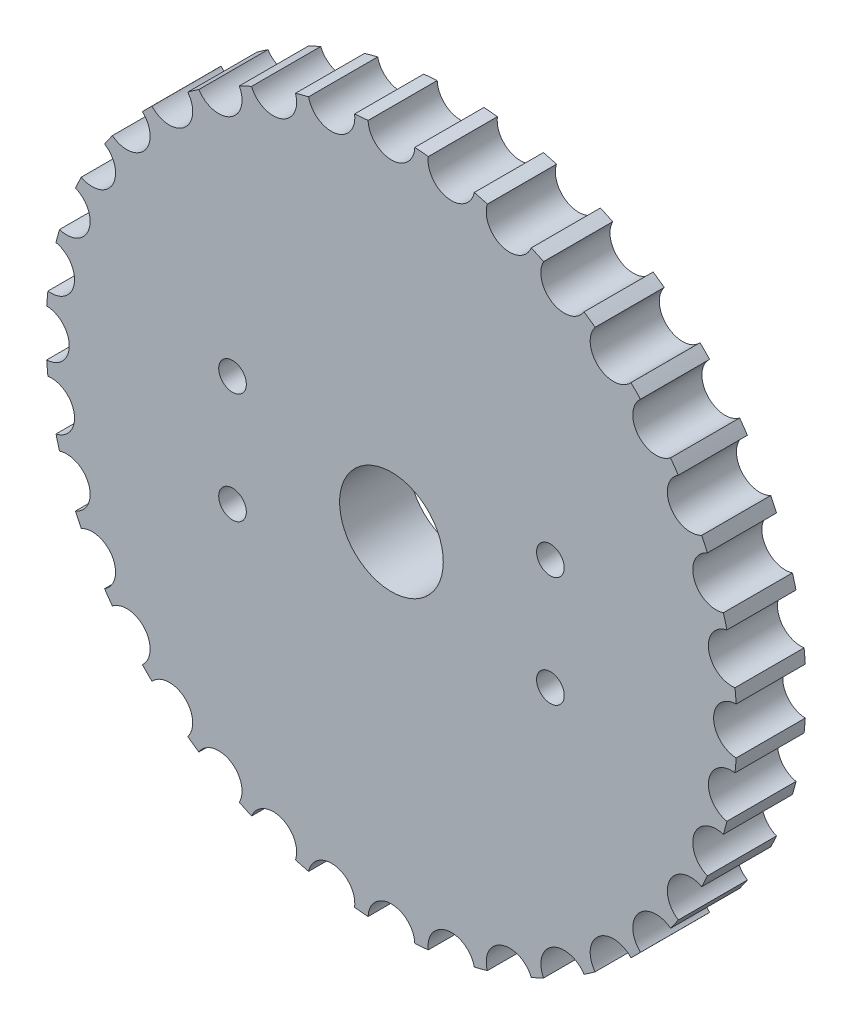
from build123d import *

# Parameters (mm, degrees)
SKETCH_1_R          = 50
EXTRUDE_1_DEPTH     = 10
SKETCH_4_R          = 7.5
CUT_EXTRUDE_3_DEPTH = 10
SKETCH_5_R          = 2
CUT_EXTRUDE_4_DEPTH = 10
SKETCH_6_R          = 3.38
CUT_EXTRUDE_5_DEPTH = 72.414284285


with BuildPart() as part:
    # 스케치1 → 보스-돌출1 (new body)
    with BuildSketch(Plane.XY):
        Circle(SKETCH_1_R)
    extrude(amount=EXTRUDE_1_DEPTH)

    # 스케치4 → 컷-돌출3 (cut)
    with BuildSketch(Plane.XY.offset(10)):
        Circle(SKETCH_4_R)
    extrude(amount=-CUT_EXTRUDE_3_DEPTH, mode=Mode.SUBTRACT)

    # 스케치5 → 컷-돌출4 (cut)
    with BuildSketch(Plane.XY.offset(10)):
        with Locations((-23, 8)):
            Circle(SKETCH_5_R)
        with Locations(Location((23, 8, 0), (0, 0, 180))):
            Circle(SKETCH_5_R)
        with Locations((23, -8)):
            Circle(SKETCH_5_R)
        with Locations(Location((-23, -8, 0), (0, 0, 180))):
            Circle(SKETCH_5_R)
    extrude(amount=-CUT_EXTRUDE_4_DEPTH, mode=Mode.SUBTRACT)

    # 스케치6 → 컷-돌출5 (cut, through all)
    with BuildSketch(Plane.XY.offset(10)):
        with Locations((0, 50)):
            Circle(SKETCH_6_R)
        with Locations((8.682408883, 49.240387651)):
            Circle(SKETCH_6_R)
        with Locations((17.101007166, 46.984631039)):
            Circle(SKETCH_6_R)
        with Locations((25, 43.301270189)):
            Circle(SKETCH_6_R)
        with Locations((32.139380484, 38.302222156)):
            Circle(SKETCH_6_R)
        with Locations((38.302222156, 32.139380484)):
            Circle(SKETCH_6_R)
        with Locations((43.301270189, 25)):
            Circle(SKETCH_6_R)
        with Locations((46.984631039, 17.101007166)):
            Circle(SKETCH_6_R)
        with Locations((49.240387651, 8.682408883)):
            Circle(SKETCH_6_R)
        with Locations((50, 0)):
            Circle(SKETCH_6_R)
        with Locations((49.240387651, -8.682408883)):
            Circle(SKETCH_6_R)
        with Locations((46.984631039, -17.101007166)):
            Circle(SKETCH_6_R)
        with Locations((43.301270189, -25)):
            Circle(SKETCH_6_R)
        with Locations((38.302222156, -32.139380484)):
            Circle(SKETCH_6_R)
        with Locations((32.139380484, -38.302222156)):
            Circle(SKETCH_6_R)
        with Locations((25, -43.301270189)):
            Circle(SKETCH_6_R)
        with Locations((17.101007166, -46.984631039)):
            Circle(SKETCH_6_R)
        with Locations((8.682408883, -49.240387651)):
            Circle(SKETCH_6_R)
        with Locations((0, -50)):
            Circle(SKETCH_6_R)
        with Locations((-8.682408883, -49.240387651)):
            Circle(SKETCH_6_R)
        with Locations((-17.101007166, -46.984631039)):
            Circle(SKETCH_6_R)
        with Locations((-25, -43.301270189)):
            Circle(SKETCH_6_R)
        with Locations((-32.139380484, -38.302222156)):
            Circle(SKETCH_6_R)
        with Locations((-38.302222156, -32.139380484)):
            Circle(SKETCH_6_R)
        with Locations((-43.301270189, -25)):
            Circle(SKETCH_6_R)
        with Locations((-46.984631039, -17.101007166)):
            Circle(SKETCH_6_R)
        with Locations((-49.240387651, -8.682408883)):
            Circle(SKETCH_6_R)
        with Locations((-50, 0)):
            Circle(SKETCH_6_R)
        with Locations((-49.240387651, 8.682408883)):
            Circle(SKETCH_6_R)
        with Locations((-46.984631039, 17.101007166)):
            Circle(SKETCH_6_R)
        with Locations((-43.301270189, 25)):
            Circle(SKETCH_6_R)
        with Locations((-38.302222156, 32.139380484)):
            Circle(SKETCH_6_R)
        with Locations((-32.139380484, 38.302222156)):
            Circle(SKETCH_6_R)
        with Locations((-25, 43.301270189)):
            Circle(SKETCH_6_R)
        with Locations((-17.101007166, 46.984631039)):
            Circle(SKETCH_6_R)
        with Locations((-8.682408883, 49.240387651)):
            Circle(SKETCH_6_R)
    extrude(amount=-CUT_EXTRUDE_5_DEPTH, mode=Mode.SUBTRACT)


solid = part.part
